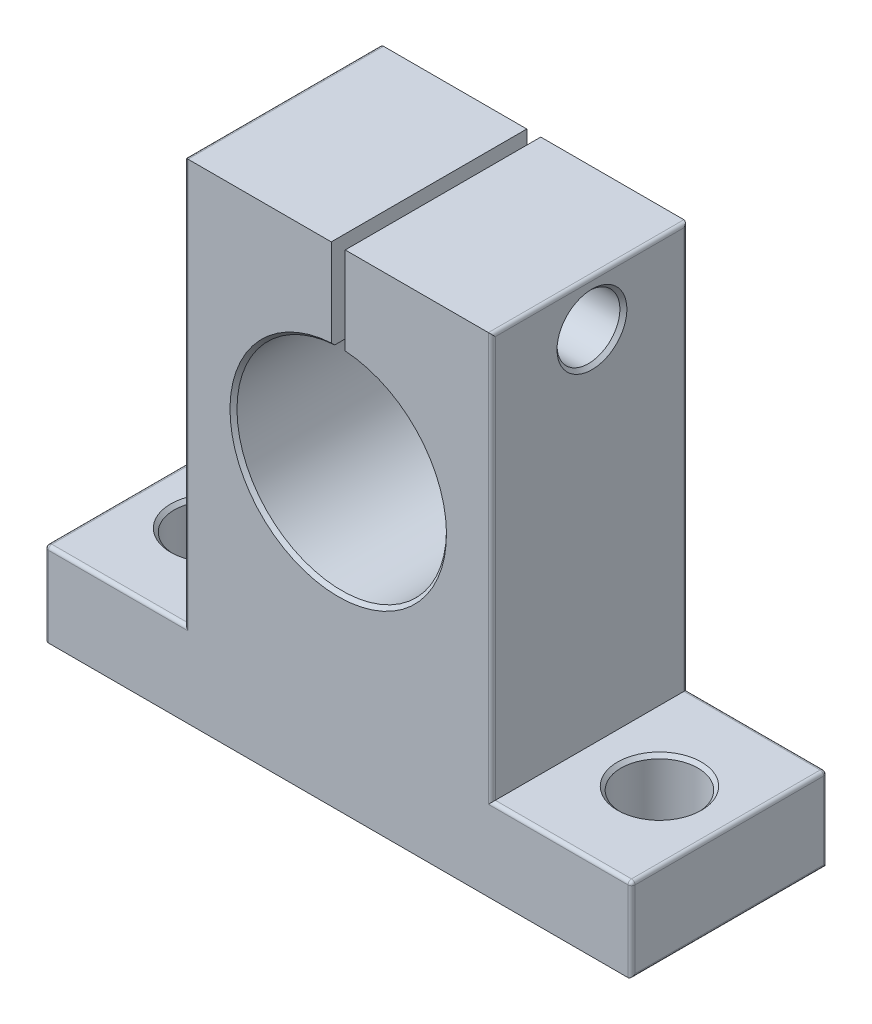
from build123d import *

# Parameters (mm, degrees)
BOSS_EXTRUDE1_DEPTH     = 14
SKETCH2_R               = 5.5
CUT_EXTRUDE1_DEPTH      = 73.965745388
CUT_EXTRUDE2_DEPTH      = 79.364532794
CUT_EXTRUDE2_DEPTH_BACK = 79.364532794
SKETCH5_R               = 4.5
CHAMFER2_SIZE           = 0.5
FILLET2_R               = 0.5


with BuildPart() as part:
    # Sketch1 → Boss-Extrude1 (new, symmetric)
    with BuildSketch(Plane.XY):
        with BuildLine():
            Line((-42, -6), (-42, 6))
            Line((-42, 6), (-22, 6))
            Line((-22, 6), (-22, 64))
            Line((-22, 64), (-1, 64))
            Line((-1, 64), (-1, 50.966629547))
            ThreePointArc((-1, 50.966629547), (0, 21), (1, 50.966629547))
            Line((1, 50.966629547), (1, 64))
            Line((1, 64), (22, 64))
            Line((22, 64), (22, 6))
            Line((22, 6), (42, 6))
            Line((42, 6), (42, -6))
            Line((42, -6), (-42, -6))
        make_face()
    extrude(amount=BOSS_EXTRUDE1_DEPTH, both=True)

    # Sketch2 → Cut-Extrude1 (cut, through all)
    with BuildSketch(Plane(origin=(0, 6, 0), x_dir=(1, 0, 0), z_dir=(0, 1, 0))):
        with Locations(Location((32, 0, 0), (0, 0, 180))):
            Circle(SKETCH2_R)
        with Locations(Location((-32, 0, 0), (0, 0, 180))):
            Circle(SKETCH2_R)
    extrude(amount=-CUT_EXTRUDE1_DEPTH, mode=Mode.SUBTRACT)

    # Sketch5 → Cut-Extrude2 (cut, two sides: drawn at the far end of the back side and taken through both)
    with BuildSketch(Plane(origin=(-1, 0, 0), x_dir=(0, 0, -1), z_dir=(1, 0, 0)).offset(-CUT_EXTRUDE2_DEPTH_BACK)):
        with Locations(Location((0.330734984, 57.483314774, 0), (0, 0, 90))):
            Circle(SKETCH5_R)
    extrude(amount=CUT_EXTRUDE2_DEPTH + CUT_EXTRUDE2_DEPTH_BACK, mode=Mode.SUBTRACT)

    # Chamfer2
    chamfer2_edges = [part.edges().sort_by_distance(p)[0] for p in [
        (0, 21, -14),
        (0, 21, 14),
        (37.5, 6, 0),
        (-26.5, 6, 0),
        (-22, 52.983314774, -0.330734984),
        (22, 52.983314774, -0.330734984),
    ]]
    chamfer(chamfer2_edges, length=CHAMFER2_SIZE)

    # Fillet2
    fillet2_edges = [part.edges().sort_by_distance(p)[0] for p in [
        (-32, 6, 14),
        (22, 35, -14),
        (32, 6, -14),
        (-42, 0, 14),
        (42, 0, -14),
        (-42, 0, -14),
        (-32, 6, -14),
        (-22, 35, -14),
        (42, 0, 14),
        (22, 64, 0),
        (42, 6, 0),
        (42, -6, 0),
        (-42, -6, 0),
        (-42, 6, 0),
        (-22, 64, 0),
        (32, 6, 14),
        (22, 35, 14),
        (-22, 35, 14),
    ]]
    fillet(fillet2_edges, radius=FILLET2_R)


solid = part.part
